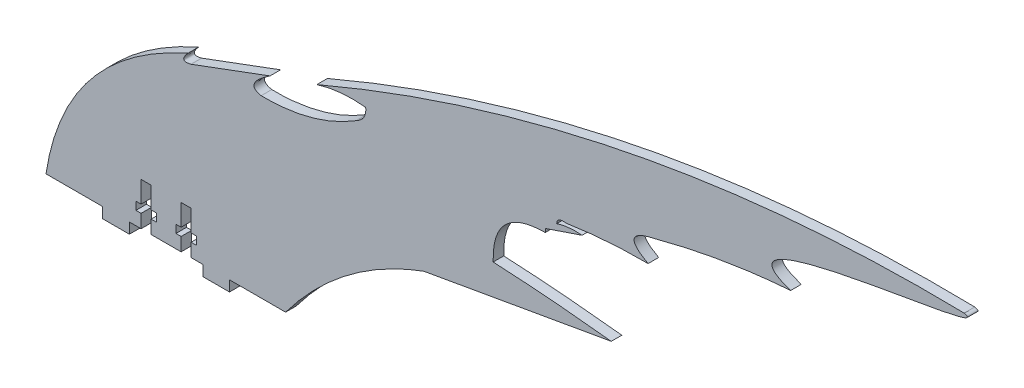
from build123d import *

# Parameters (mm, degrees)
BOSS_EXTRUDE1_DEPTH = 3.175
SKETCH3_W           = 8
SKETCH3_H           = 3.175
BOSS_EXTRUDE2_DEPTH = 3.175
CUT_EXTRUDE1_DEPTH  = 295.302026077


with BuildPart() as part:
    # Sketch2 → Boss-Extrude1 (new body)
    with BuildSketch(Plane.XY):
        with BuildLine():
            Line((0, 0), (71.821224644, 0))
            add(Edge.make_bspline(
                [(113.265068403, 31.345085694), (88.49122235, 22.260941948), (71.821224644, 0)],
                knots=[0, 0, 0, 1, 1, 1], degree=2))
            Line((113.265068403, 31.345085694), (169.435947463, 41.242848876))
            add(Edge.make_bspline(
                [(134.041587412, 44.130878692), (151.78543129, 43.239991284), (169.435947463, 41.242848876)],
                knots=[0, 0, 0, 1, 1, 1], degree=2))
            add(Edge.make_bspline(
                [(149.664509426, 59.598208841), (133.564564098, 59.446315657), (134.041587412, 44.130878692)],
                knots=[0, 0, 0, 1, 1, 1], degree=2))
            Line((149.664509426, 59.598208841), (149.685676558, 60.6678268))
            Line((149.685676558, 60.6678268), (160.696312712, 64.401472217))
            add(Edge.make_bspline(
                [(160.696312712, 64.401472217), (156.792494019, 64.794773064), (153.080099679, 63.60900386)],
                knots=[0, 0, 0, 1, 1, 1], degree=2))
            add(Edge.make_bspline(
                [(153.080099679, 63.60900386), (153.21581852, 65.543109048), (155.855294119, 65.154686594)],
                knots=[0, 0, 0, 1, 1, 1], degree=2))
            add(Edge.make_bspline(
                [(155.855294119, 65.154686594), (168.070276532, 67.039683705), (180.482777211, 66.945466473)],
                knots=[0, 0, 0, 1, 1, 1], degree=2))
            add(Edge.make_bspline(
                [(180.482777211, 66.945466473), (171.187708605, 72.067803505), (182.417352528, 74.400222782)],
                knots=[0, 0, 0, 1, 1, 1], degree=2))
            add(Edge.make_bspline(
                [(182.417352528, 74.400222782), (202.456511943, 79.784692432), (223.217555695, 81.328050857)],
                knots=[0, 0, 0, 1, 1, 1], degree=2))
            add(Edge.make_bspline(
                [(275.233904512, 101.469551945), (286.543816843, 98.715878969), (194.296992898, 91.024580871), (223.217555695, 81.328050857)],
                knots=[0, 0, 0, 0, 1, 1, 1, 1], degree=3))
            add(Edge.make_bspline(
                [(275.233904512, 101.469551945), (174.061816158, 103.537553967), (81.190900328, 63.774105239)],
                knots=[0, 0, 0, 1, 1, 1], degree=2))
            add(Edge.make_bspline(
                [(81.190900328, 63.774105239), (88.381783724, 65.999307209), (95.832537282, 65.154686594)],
                knots=[0, 0, 0, 1, 1, 1], degree=2))
            add(Edge.make_bspline(
                [(95.832537282, 65.154686594), (96.183075401, 62.049994654), (93.003333324, 60.309886397)],
                knots=[0, 0, 0, 1, 1, 1], degree=2))
            add(Edge.make_bspline(
                [(93.003333324, 60.309886397), (79.982990497, 52.245061614), (64.511543782, 52.550984526)],
                knots=[0, 0, 0, 1, 1, 1], degree=2))
            add(Edge.make_bspline(
                [(64.511543782, 52.550984526), (59.095264392, 53.626200699), (67.149577001, 58.996482621)],
                knots=[0, 0, 0, 1, 1, 1], degree=2))
            Line((67.149577001, 58.996482621), (43.476372801, 50.196200023))
            add(Edge.make_bspline(
                [(43.476372801, 50.196200023), (39.603225427, 49.243326926), (42.576727954, 52.611474892)],
                knots=[0, 0, 0, 1, 1, 1], degree=2))
            add(Edge.make_bspline(
                [(42.576727954, 52.611474892), (5.440445948, 36.121326287), (0, 0)],
                knots=[0, 0, 0, 1, 1, 1], degree=2))
        make_face()
    extrude(amount=BOSS_EXTRUDE1_DEPTH)

    # Sketch3 → Boss-Extrude2 (add)
    with BuildSketch(Plane.XY.offset(3.175)):
        with Locations((21, -1.5875)):
            Rectangle(SKETCH3_W, SKETCH3_H)
        with Locations((51, -1.5875)):
            Rectangle(SKETCH3_W, SKETCH3_H)
    extrude(amount=-BOSS_EXTRUDE2_DEPTH)

    # Sketch4 → Cut-Extrude1 (cut, through all)
    with BuildSketch(Plane.XY.offset(3.175)):
        Polygon((28.5, 4), (28.5, 0), (31.5, 0), (31.5, 4), (33.05, 4), (33.05, 6.4), (31.5, 6.4), (31.5, 12.825), (28.5, 12.825), (28.5, 6.4), (26.95, 6.4), (26.95, 4), align=None)
        Polygon((40.5, 4), (40.5, 0), (43.5, 0), (43.5, 4), (45.05, 4), (45.05, 6.4), (43.5, 6.4), (43.5, 12.825), (40.5, 12.825), (40.5, 6.4), (38.95, 6.4), (38.95, 4), align=None)
    extrude(amount=-CUT_EXTRUDE1_DEPTH, mode=Mode.SUBTRACT)


solid = part.part
